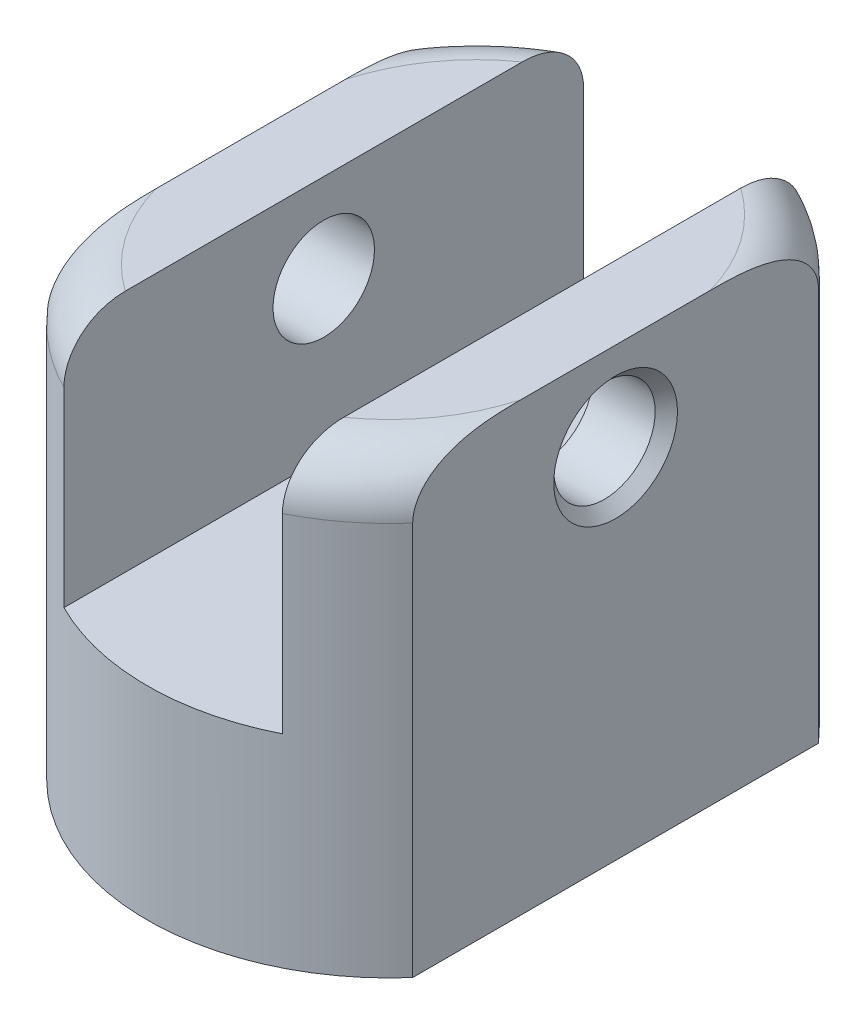
from build123d import *

# Parameters (mm, degrees)
BOSS_EXTRUDE1_DEPTH         = 5
BOSS_EXTRUDE2_DEPTH         = 6
FILLET1_R                   = 1.3
M3_TAPPED_HOLE1_D           = 2.5
M3_TAPPED_HOLE1_CSINK_D     = 3.05
M3_TAPPED_HOLE1_CSINK_ANGLE = 90


with BuildPart() as part:
    # Sketch1 → Boss-Extrude1 (new body)
    with BuildSketch(Plane(origin=(0, 0, 0), x_dir=(1, 0, 0), z_dir=(0, 1, 0))):
        with BuildLine():
            Line((-4.5, 0), (-4.5, 10))
            ThreePointArc((-4.5, 10), (0, 12.044483976), (4.5, 10))
            Line((4.5, 10), (4.5, 0))
            ThreePointArc((4.5, 0), (0, -2.044483976), (-4.5, 0))
        make_face()
    extrude(amount=BOSS_EXTRUDE1_DEPTH)

    # Sketch2 → Boss-Extrude2 (add)
    with BuildSketch(Plane(origin=(0, 5, 0), x_dir=(1, 0, 0), z_dir=(0, 1, 0))):
        with BuildLine():
            Line((-2.692561773, 11.403358064), (-2.692561773, -1.403358064))
            ThreePointArc((-2.692561773, -1.403358064), (-3.66409466, -0.78901897), (-4.5, 0))
            Line((-4.5, 0), (-4.5, 10))
            ThreePointArc((-4.5, 10), (-3.66409466, 10.78901897), (-2.692561773, 11.403358064))
        make_face()
        with BuildLine():
            Line((4.5, 10), (4.5, 0))
            ThreePointArc((4.5, 0), (3.66409466, -0.78901897), (2.692561773, -1.403358064))
            Line((2.692561773, -1.403358064), (2.692561773, 11.403358064))
            ThreePointArc((2.692561773, 11.403358064), (3.66409466, 10.78901897), (4.5, 10))
        make_face()
    extrude(amount=BOSS_EXTRUDE2_DEPTH)

    # Fillet1
    fillet1_edges = [part.edges().sort_by_distance(p)[0] for p in [
        (-3.66409466, 11, -10.78901897),
        (-3.66409466, 11, 0.78901897),
        (3.66409466, 11, -10.78901897),
        (3.66409466, 11, 0.78901897),
    ]]
    fillet(fillet1_edges, radius=FILLET1_R)

    # M3 Tapped Hole1 (through all)
    with Locations(Plane(origin=(4.5, 0, 0), x_dir=(0, 0, -1), z_dir=(1, 0, 0))):
        with Locations((5, 8.818847832)):
            CounterSinkHole(M3_TAPPED_HOLE1_D / 2, M3_TAPPED_HOLE1_CSINK_D / 2, counter_sink_angle=M3_TAPPED_HOLE1_CSINK_ANGLE)


solid = part.part
